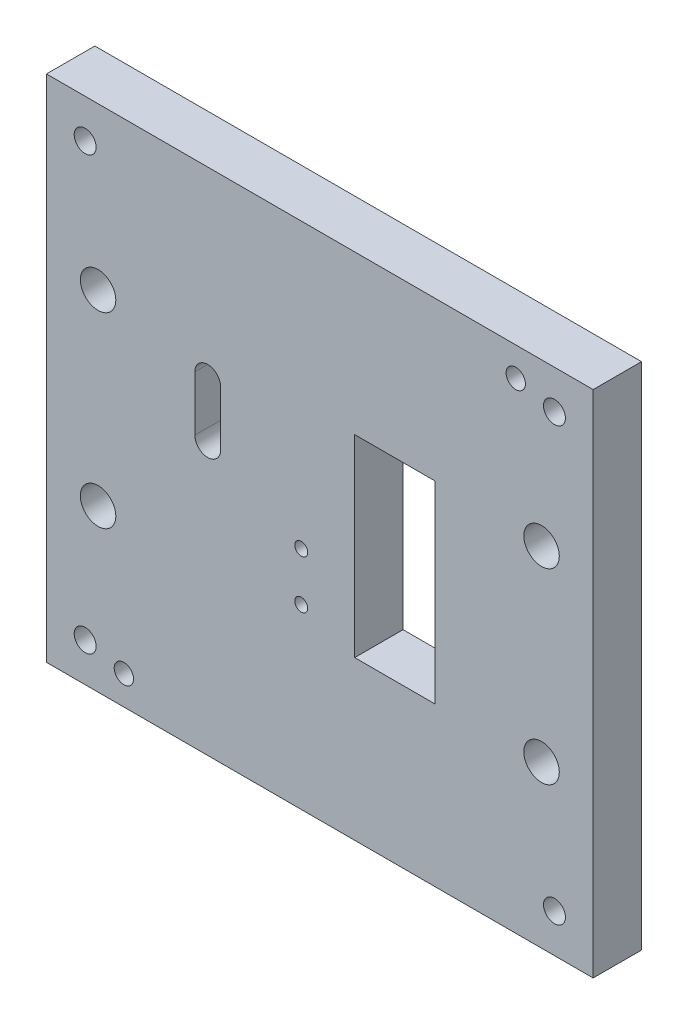
from build123d import *

# Parameters (mm, degrees)
SKETCH2_W                           = 169.5
SKETCH2_H                           = 158
SKETCH2_R                           = 2
SKETCH2_W_2                         = 24.88
SKETCH2_H_2                         = 59.88
BOSS_EXTRUDE1_DEPTH                 = 15
M8X1_25_TAPPED_HOLE1_D              = 6.8
M8X1_25_TAPPED_HOLE1_DEPTH          = 7.5
M8X1_25_TAPPED_HOLE1_TIP            = 2.042926105
F_6_0MM_CLEARANCE_DOWEL_HOLE1_D     = 6
F_6_0MM_CLEARANCE_DOWEL_HOLE1_DEPTH = 10
SKETCH7_R                           = 14
CUT_EXTRUDE1_DEPTH                  = 2
M10_CLEARANCE_HOLE1_D               = 11


with BuildPart() as part:
    # Sketch2 → Boss-Extrude1 (new body)
    with BuildSketch(Plane.XY):
        with Locations((34.75, 0)):
            Rectangle(SKETCH2_W, SKETCH2_H)
        with Locations((29, -9)):
            Circle(SKETCH2_R, mode=Mode.SUBTRACT)
        with Locations((29, -24)):
            Circle(SKETCH2_R, mode=Mode.SUBTRACT)
        with BuildLine():
            Line((-4, 22), (-4, 5))
            ThreePointArc((-4, 5), (0, 1), (4, 5))
            Line((4, 5), (4, 22))
            ThreePointArc((4, 22), (0, 26), (-4, 22))
        make_face(mode=Mode.SUBTRACT)
        with Locations((58, 0)):
            Rectangle(SKETCH2_W_2, SKETCH2_H_2, mode=Mode.SUBTRACT)
    extrude(amount=-BOSS_EXTRUDE1_DEPTH)

    # M8x1.25 Tapped Hole1
    with Locations(Plane(origin=(0, 0, 0), x_dir=(0.9063077870366375, -0.42261826174072625, 0), z_dir=(0, 0, 1))):
        with Locations((125.743510643, -15.291158594), (69.11266357, 106.154084869), (-62.755119444, 44.663127785), (-6.124272371, -76.782115678)):
            Hole(M8X1_25_TAPPED_HOLE1_D / 2, depth=M8X1_25_TAPPED_HOLE1_DEPTH)
            with Locations((0, 0, -(M8X1_25_TAPPED_HOLE1_DEPTH + M8X1_25_TAPPED_HOLE1_TIP / 2))):  # 118° drill point
                Cone(0, M8X1_25_TAPPED_HOLE1_D / 2, M8X1_25_TAPPED_HOLE1_TIP, mode=Mode.SUBTRACT)

    # Ø6.0mm Clearance Dowel Hole1
    with Locations(Plane(origin=(0, 0, 0), x_dir=(0.9063077870366375, -0.42261826174072625, 0), z_dir=(0, 0, 1))):
        with Locations((56.96911534, 103.801589089), (6.019275859, -74.429619898)):
            Hole(F_6_0MM_CLEARANCE_DOWEL_HOLE1_D / 2, depth=F_6_0MM_CLEARANCE_DOWEL_HOLE1_DEPTH)

    # Sketch7 → Cut-Extrude1 (cut)
    with BuildSketch(Plane(origin=(0, 0, -15), x_dir=(-1, 0, 0), z_dir=(0, 0, -1))):
        with Locations((-103.5, 29)):
            Circle(SKETCH7_R)
        with Locations((34, 29)):
            Circle(SKETCH7_R)
        with Locations((34, -29)):
            Circle(SKETCH7_R)
        with Locations((-103.5, -29)):
            Circle(SKETCH7_R)
    extrude(amount=-CUT_EXTRUDE1_DEPTH, mode=Mode.SUBTRACT)

    # M10 Clearance Hole1 (through all)
    with Locations(Plane(origin=(0, 0, 0), x_dir=(0.9063077870366375, -0.42261826174072625, 0), z_dir=(0, 0, 1))):
        with Locations((-43.07039435, 11.913904925), (-18.558535169, -40.651946723), (81.546926368, 70.023915914), (106.058785549, 17.458064266)):
            Hole(M10_CLEARANCE_HOLE1_D / 2)


solid = part.part
